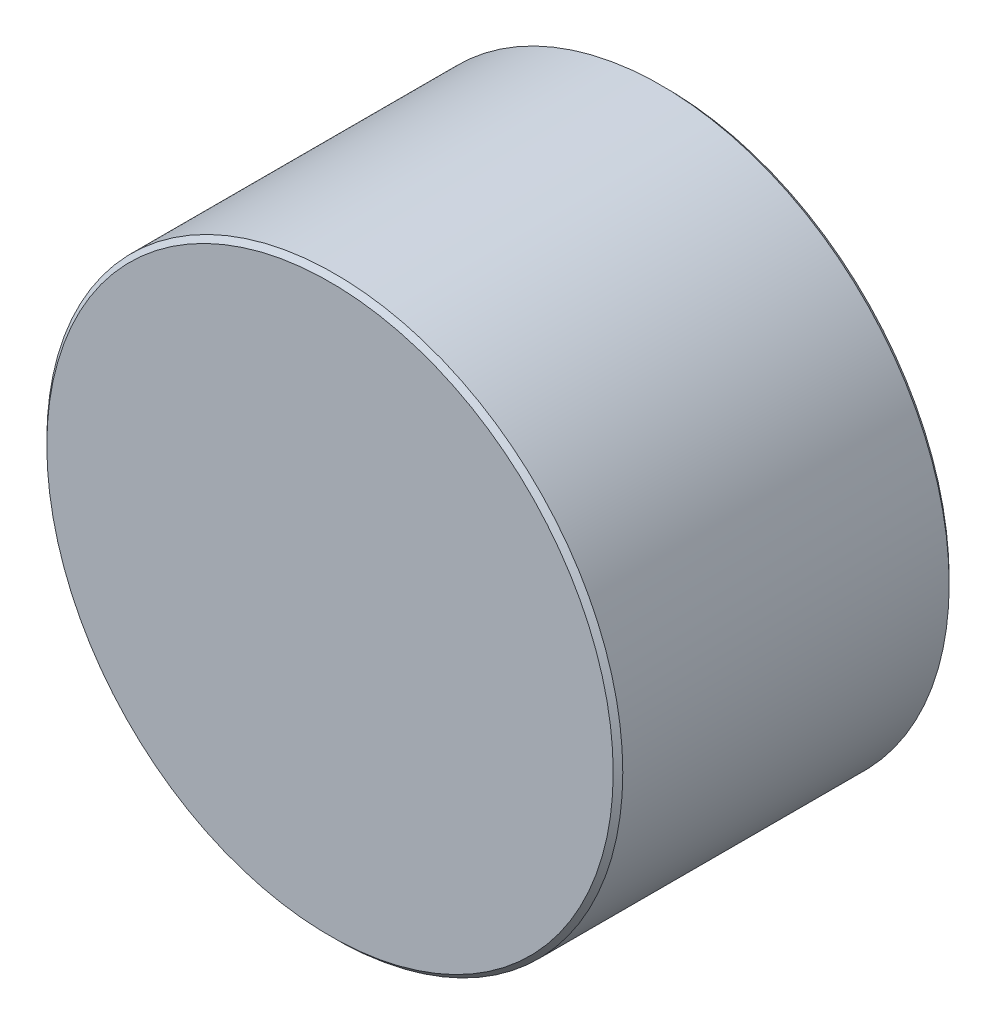
from build123d import *

# Parameters (mm, degrees)
SKETCH1_R           = 6
BOSS_EXTRUDE1_DEPTH = 7
CHAMFER1_SIZE       = 0.1


with BuildPart() as part:
    # Sketch1 → Boss-Extrude1 (new body)
    with BuildSketch(Plane.XY):
        Circle(SKETCH1_R)
    extrude(amount=BOSS_EXTRUDE1_DEPTH)

    # Chamfer1
    chamfer1_edges = [part.edges().sort_by_distance(p)[0] for p in [
        (-6, 0, 0),
        (-6, 0, 7),
    ]]
    chamfer(chamfer1_edges, length=CHAMFER1_SIZE)


solid = part.part
